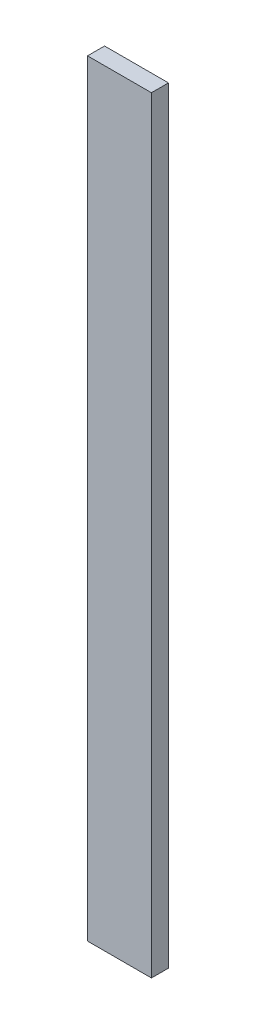
from build123d import *

# Parameters (mm, degrees)
CROQUIS1_W              = 30
CROQUIS1_H              = 360
SALIENTE_EXTRUIR1_DEPTH = 8


with BuildPart() as part:
    # Croquis1 → Saliente-Extruir1 (new body)
    with BuildSketch(Plane.XY):
        Rectangle(CROQUIS1_W, CROQUIS1_H)
    extrude(amount=SALIENTE_EXTRUIR1_DEPTH)


solid = part.part
